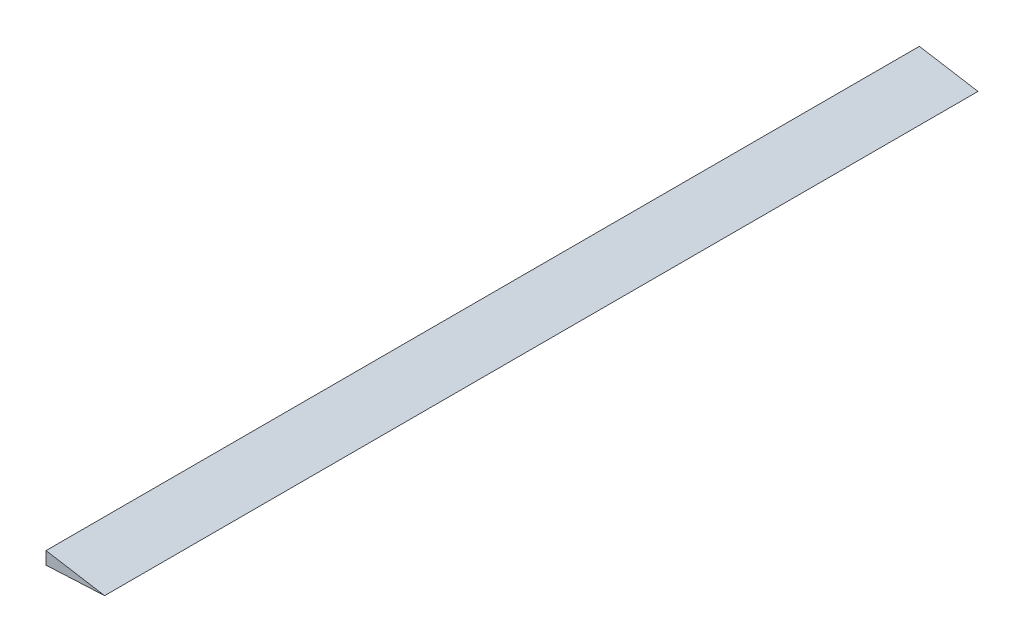
from build123d import *

# Parameters (mm, degrees)
BOSS_EXTRUDE2_DEPTH = 756.919746


with BuildPart() as part:
    # Sketch2 → Boss-Extrude2 (new body)
    with BuildSketch(Plane(origin=(0, 0, -761.999746), x_dir=(-1, 0, 0), z_dir=(0, 0, -1))):
        Polygon((-306.8495768, -2.516115741), (-306.8495768, 8.449856001), (-357.6495768, 0), align=None)
    extrude(amount=-BOSS_EXTRUDE2_DEPTH)


solid = part.part
